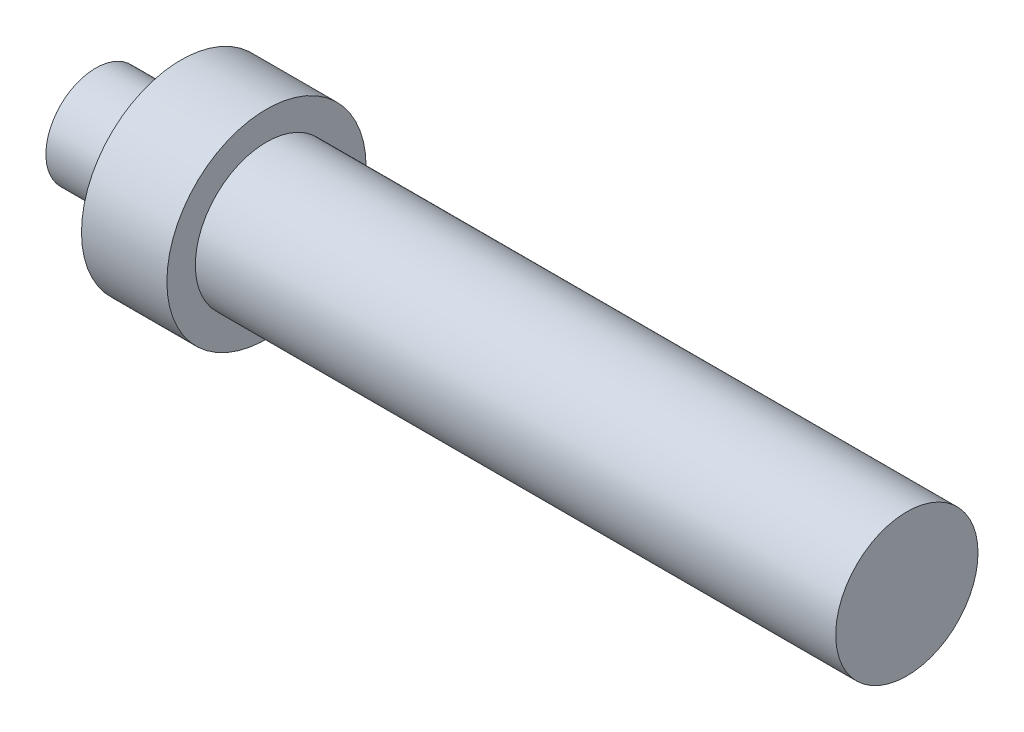
from build123d import *


with BuildPart() as part:
    # Sketch1 → Revolve1 (revolve)
    with BuildSketch(Plane.XY, mode=Mode.PRIVATE) as revolve1_sk:
        Polygon((0, 0), (0, 3.5), (6, 3.5), (6, 7), (12, 7), (12, 5), (57, 5), (57, 0), align=None)
    revolve(revolve1_sk.sketch.rotate(Axis((57, 0, 0), (-1, 0, 0)), 90), axis=Axis((57, 0, 0), (-1, 0, 0)))


solid = part.part
